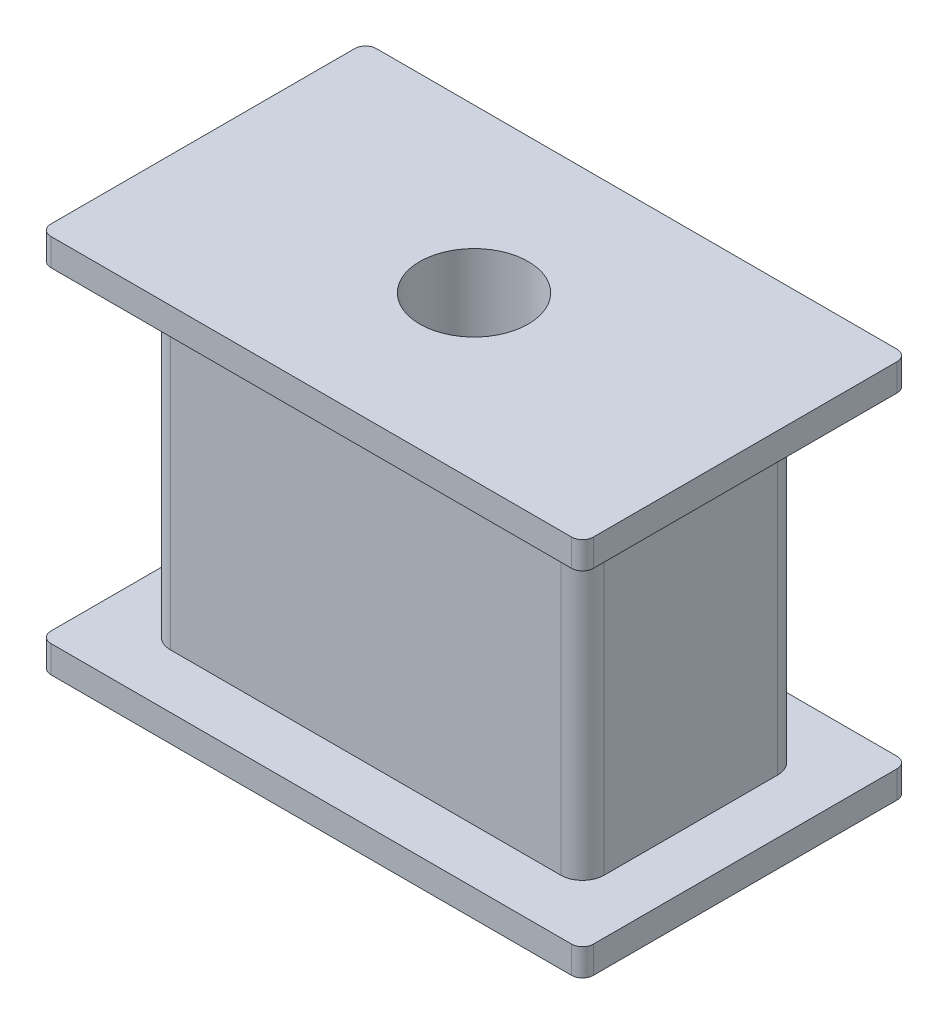
from build123d import *

# Parameters (mm, degrees)
SKETCH1_W          = 40
SKETCH1_H          = 20
MAIN_BODY_DEPTH    = 30
SKETCH2_W          = 50
SKETCH2_H          = 30
FLANGE_1_DEPTH     = 2.5
SKETCH4_W          = 50
SKETCH4_H          = 30
SKETCH4_W_2        = 40
SKETCH4_H_2        = 20
FLANGE_2_DEPTH     = 2.5
SKETCH5_R          = 5
HOLE_DEPTH         = 46.552167896
MAIN_BODY_FILLET_R = 2
FLANGE_FILLET_R    = 1


with BuildPart() as part:
    # Sketch1 → Main Body (new body)
    with BuildSketch(Plane(origin=(0, 0, 0), x_dir=(1, 0, 0), z_dir=(0, 1, 0))):
        Rectangle(SKETCH1_W, SKETCH1_H)
    extrude(amount=MAIN_BODY_DEPTH)

    # Sketch2 → Flange 1 (add)
    with BuildSketch(Plane(origin=(0, 30, 0), x_dir=(1, 0, 0), z_dir=(0, 1, 0))):
        Rectangle(SKETCH2_W, SKETCH2_H)
    extrude(amount=FLANGE_1_DEPTH)

    # Sketch4 → Flange 2 (add)
    # profile 1 of 2: a face of its own
    with BuildSketch(Plane.XZ):
        Rectangle(SKETCH4_W, SKETCH4_H)
        Rectangle(SKETCH4_W_2, SKETCH4_H_2, mode=Mode.SUBTRACT)
    # profile 2 of 2: a face of its own
    with BuildSketch(Plane.XZ):
        Rectangle(SKETCH4_W_2, SKETCH4_H_2)
    extrude(amount=FLANGE_2_DEPTH)

    # Sketch5 → Hole (cut, through all)
    with BuildSketch(Plane(origin=(0, 32.5, 0), x_dir=(1, 0, 0), z_dir=(0, 1, 0))):
        with Locations(Location((0, 0, 0), (0, 0, 270))):
            Circle(SKETCH5_R)
    extrude(amount=-HOLE_DEPTH, mode=Mode.SUBTRACT)

    # Main Body Fillet
    main_body_fillet_edges = [part.edges().sort_by_distance(p)[0] for p in [
        (20, 15, 10),
        (-20, 15, 10),
        (-20, 15, -10),
        (20, 15, -10),
    ]]
    fillet(main_body_fillet_edges, radius=MAIN_BODY_FILLET_R)

    # Flange Fillet
    flange_fillet_edges = [part.edges().sort_by_distance(p)[0] for p in [
        (25, 31.25, 15),
        (25, 31.25, -15),
        (-25, 31.25, -15),
        (-25, 31.25, 15),
        (25, -1.25, 15),
        (-25, -1.25, 15),
        (-25, -1.25, -15),
        (25, -1.25, -15),
    ]]
    fillet(flange_fillet_edges, radius=FLANGE_FILLET_R)


solid = part.part
